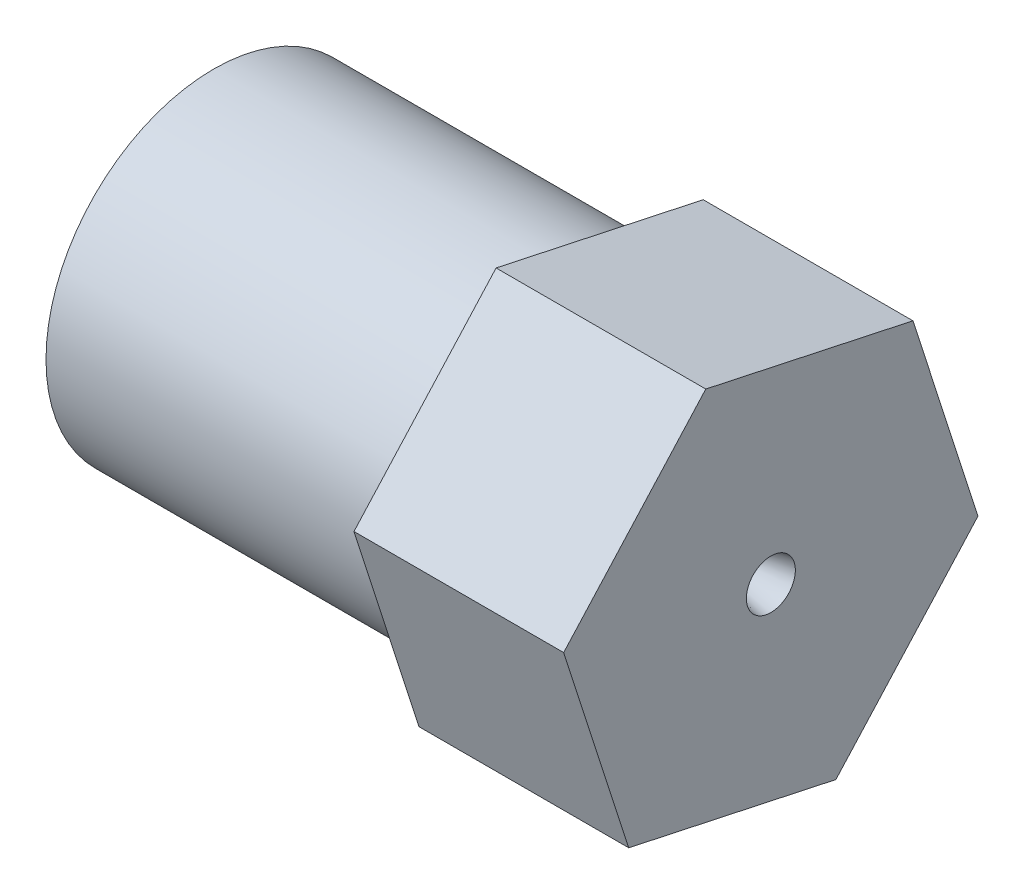
from build123d import *

# Parameters (mm, degrees)
SKETCH4_R           = 10.16
BOSS_EXTRUDE1_DEPTH = 12.7
FILLET1_R           = 0.635


with BuildPart() as part:
    # Sketch1 → Revolve1 (revolve)
    with BuildSketch(Plane.XY, mode=Mode.PRIVATE) as revolve1_sk:
        with BuildLine():
            Line((-1.060660172, 1.439339828), (-3.136384374, 3.51506403))
            ThreePointArc((-3.136384374, 3.51506403), (-4.166428506, 4.203317516), (-5.381448404, 4.445))
            Line((-5.381448404, 4.445), (-13.462, 4.445))
            Line((-13.462, 4.445), (-13.462, 4.699))
            ThreePointArc((-13.462, 4.699), (-13.499197439, 4.788802561), (-13.589, 4.826))
            Line((-13.589, 4.826), (-19.304, 4.826))
            ThreePointArc((-19.304, 4.826), (-19.753012806, 5.011987194), (-19.939, 5.461))
            Line((-19.939, 5.461), (-19.939, 6.8199))
            ThreePointArc((-19.939, 6.8199), (-19.976197439, 6.909702561), (-20.066, 6.9469))
            Line((-20.066, 6.9469), (-24.892, 6.9469))
            Line((-24.892, 6.9469), (-24.892, 7.8994))
            ThreePointArc((-24.892, 7.8994), (-24.929197439, 7.989202561), (-25.019, 8.0264))
            Line((-25.019, 8.0264), (-31.115, 8.0264))
            ThreePointArc((-31.115, 8.0264), (-31.564012806, 8.212387194), (-31.75, 8.6614))
            Line((-31.75, 8.6614), (-31.75, 10.16))
            Line((-31.75, 10.16), (-10.712624421, 10.16))
            Line((-10.712624421, 10.16), (1.987375579, 10.16))
            Line((1.987375579, 10.16), (1.987375579, 1.483239697))
            add(Edge.make_bspline(
                [(1.987375579, 1.483239697), (1.027632818, 1.348356649), (0.136808057, 1.024122952)],
                knots=[0, 0, 0, 1, 1, 1], degree=2))
            ThreePointArc((0.136808057, 1.024122952), (0.069459271, 1.006076899), (0, 1))
            ThreePointArc((0, 1), (-0.574025149, 1.114180701), (-1.060660172, 1.439339828))
        make_face()
    revolve(revolve1_sk.sketch.rotate(Axis((0, 0, 0), (1, 0, 0)), 90), axis=Axis((0, 0, 0), (1, 0, 0)))

    # Sketch4 → Boss-Extrude1 (add)
    with BuildSketch(Plane(origin=(1.987375579, 0, 0), x_dir=(0, 0, -1), z_dir=(1, 0, 0))):
        Polygon((3.940411868, -12.211607701), (12.545768424, -2.693307071), (8.605356556, 9.51830063), (-3.940411868, 12.211607701), (-12.545768424, 2.693307071), (-8.605356556, -9.51830063), align=None)
        with Locations(Location((0, 0, 0), (0, 0, 180))):
            Circle(SKETCH4_R, mode=Mode.SUBTRACT)
    extrude(amount=-BOSS_EXTRUDE1_DEPTH)

    # Fillet1
    fillet1_edges = [part.edges().sort_by_distance(p)[0] for p in [
        (-10.712624421, 0, -10.16),
    ]]
    fillet(fillet1_edges, radius=FILLET1_R)


solid = part.part
